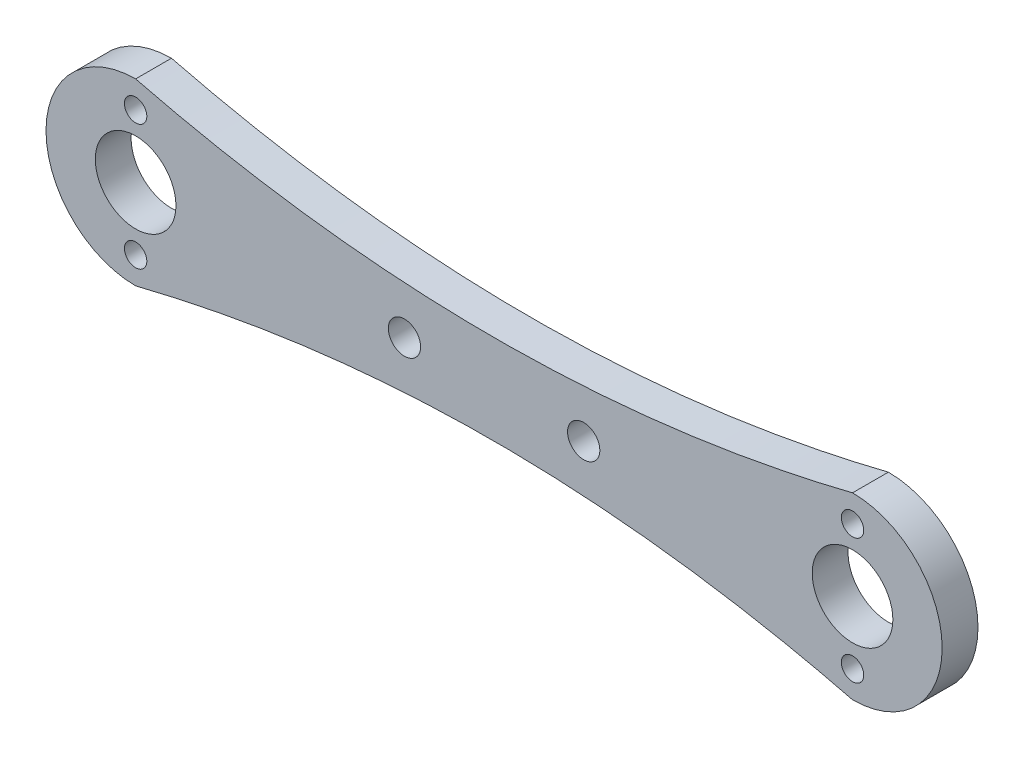
from build123d import *

# Parameters (mm, degrees)
ESQUISSE1_R             = 1.25
ESQUISSE1_R_2           = 4.5
BOSS_EXTRU_1_DEPTH      = 4
ESQUISSE2_R             = 1.8
ENL_V_MAT_EXTRU_1_DEPTH = 10


with BuildPart() as part:
    # Esquisse1 → Boss.-Extru.1 (new body)
    with BuildSketch(Plane.XY):
        with BuildLine():
            ThreePointArc((0, 10.00000024), (-10.00000024, 0), (0, -10.00000024))
            add(Edge.make_bspline(
                [(0, -10.00000024), (40, 0), (80, -10.00000024)],
                knots=[0, 0, 0, 1, 1, 1], degree=2))
            ThreePointArc((80, -10.00000024), (90.00000024, 0), (80, 10.00000024))
            add(Edge.make_bspline(
                [(0, 10.00000024), (40, 0), (80, 10.00000024)],
                knots=[0, 0, 0, 1, 1, 1], degree=2))
        make_face()
        with Locations((80, -7)):
            Circle(ESQUISSE1_R, mode=Mode.SUBTRACT)
        with Locations((80, 7)):
            Circle(ESQUISSE1_R, mode=Mode.SUBTRACT)
        with Locations((0, -7)):
            Circle(ESQUISSE1_R, mode=Mode.SUBTRACT)
        with Locations((0, 7)):
            Circle(ESQUISSE1_R, mode=Mode.SUBTRACT)
        with Locations((80, 0)):
            Circle(ESQUISSE1_R_2, mode=Mode.SUBTRACT)
        Circle(ESQUISSE1_R_2, mode=Mode.SUBTRACT)
    extrude(amount=BOSS_EXTRU_1_DEPTH)

    # Esquisse2 → Enlèv. mat.-Extru.1 (cut)
    with BuildSketch(Plane(origin=(0, 0, 0), x_dir=(-1, 0, 0), z_dir=(0, 0, -1))):
        with Locations((-50, 0)):
            Circle(ESQUISSE2_R)
        with Locations((-30, 0)):
            Circle(ESQUISSE2_R)
    extrude(amount=-ENL_V_MAT_EXTRU_1_DEPTH, mode=Mode.SUBTRACT)


solid = part.part
